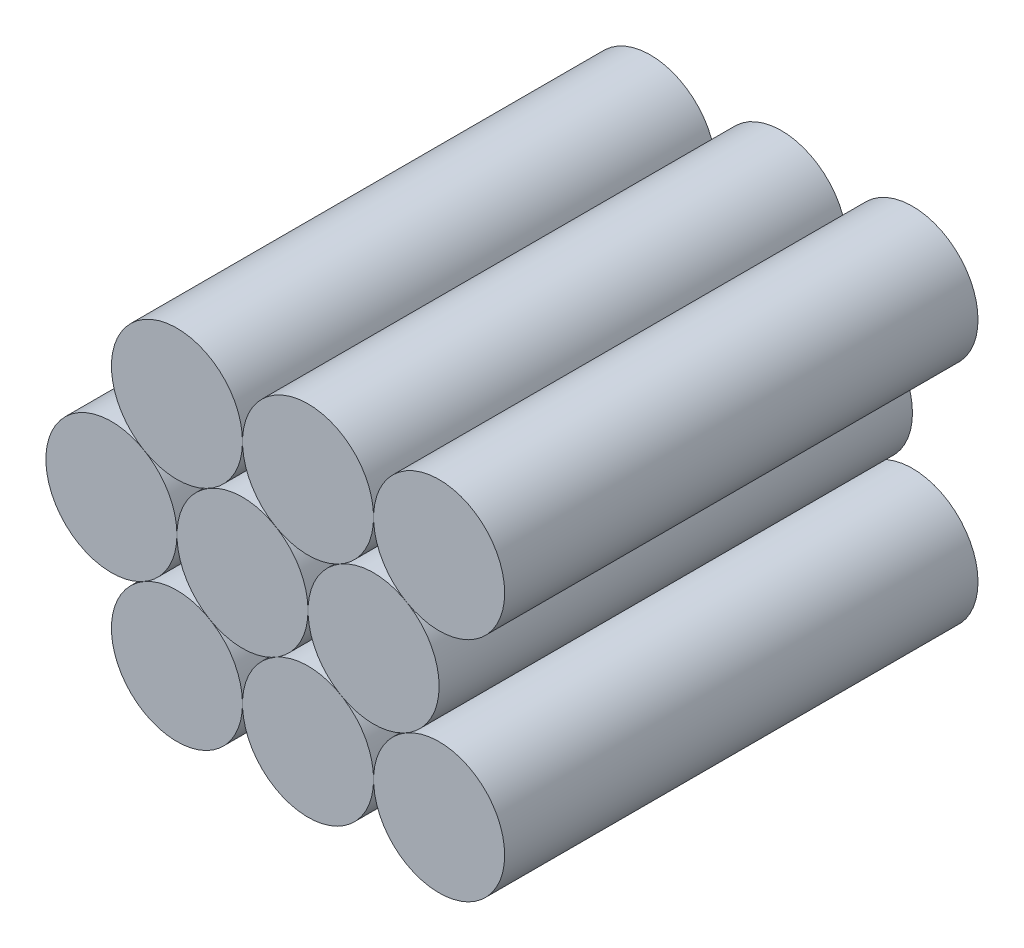
from build123d import *

# Parameters (mm, degrees)
ESQUISSE1_R          = 9
BOSS_EXTRU_1_DEPTH   = 65
BOSS_EXTRU_1_2_DEPTH = 65
BOSS_EXTRU_1_3_DEPTH = 65
BOSS_EXTRU_1_4_DEPTH = 65
BOSS_EXTRU_1_5_DEPTH = 65
BOSS_EXTRU_1_6_DEPTH = 65
BOSS_EXTRU_1_7_DEPTH = 65
BOSS_EXTRU_1_8_DEPTH = 65
BOSS_EXTRU_1_9_DEPTH = 65


with BuildPart() as part:
    # Esquisse1 → Boss.-Extru.1 (new body)
    with BuildSketch(Plane.XY):
        with Locations((-18, 0)):
            Circle(ESQUISSE1_R)
    extrude(amount=BOSS_EXTRU_1_DEPTH)


with BuildPart() as body_2:
    # Esquisse1 → Boss.-Extru.1 2 (new body)
    with BuildSketch(Plane.XY):
        with Locations((-9, 15.588457268)):
            Circle(ESQUISSE1_R)
    extrude(amount=BOSS_EXTRU_1_2_DEPTH)


with BuildPart() as body_3:
    # Esquisse1 → Boss.-Extru.1 3 (new body)
    with BuildSketch(Plane.XY):
        Circle(ESQUISSE1_R)
    extrude(amount=BOSS_EXTRU_1_3_DEPTH)


with BuildPart() as body_4:
    # Esquisse1 → Boss.-Extru.1 4 (new body)
    with BuildSketch(Plane.XY):
        with Locations((9, 15.588457268)):
            Circle(ESQUISSE1_R)
    extrude(amount=BOSS_EXTRU_1_4_DEPTH)


with BuildPart() as body_5:
    # Esquisse1 → Boss.-Extru.1 5 (new body)
    with BuildSketch(Plane.XY):
        with Locations((27, 15.588457268)):
            Circle(ESQUISSE1_R)
    extrude(amount=BOSS_EXTRU_1_5_DEPTH)


with BuildPart() as body_6:
    # Esquisse1 → Boss.-Extru.1 6 (new body)
    with BuildSketch(Plane.XY):
        with Locations((18, 0)):
            Circle(ESQUISSE1_R)
    extrude(amount=BOSS_EXTRU_1_6_DEPTH)


with BuildPart() as body_7:
    # Esquisse1 → Boss.-Extru.1 7 (new body)
    with BuildSketch(Plane.XY):
        with Locations((9, -15.588457268)):
            Circle(ESQUISSE1_R)
    extrude(amount=BOSS_EXTRU_1_7_DEPTH)


with BuildPart() as body_8:
    # Esquisse1 → Boss.-Extru.1 8 (new body)
    with BuildSketch(Plane.XY):
        with Locations((-9, -15.588457268)):
            Circle(ESQUISSE1_R)
    extrude(amount=BOSS_EXTRU_1_8_DEPTH)


with BuildPart() as body_9:
    # Esquisse1 → Boss.-Extru.1 9 (new body)
    with BuildSketch(Plane.XY):
        with Locations((27, -15.588457268)):
            Circle(ESQUISSE1_R)
    extrude(amount=BOSS_EXTRU_1_9_DEPTH)


solid = Compound([part.part, body_2.part, body_3.part, body_4.part, body_5.part, body_6.part, body_7.part, body_8.part, body_9.part])
